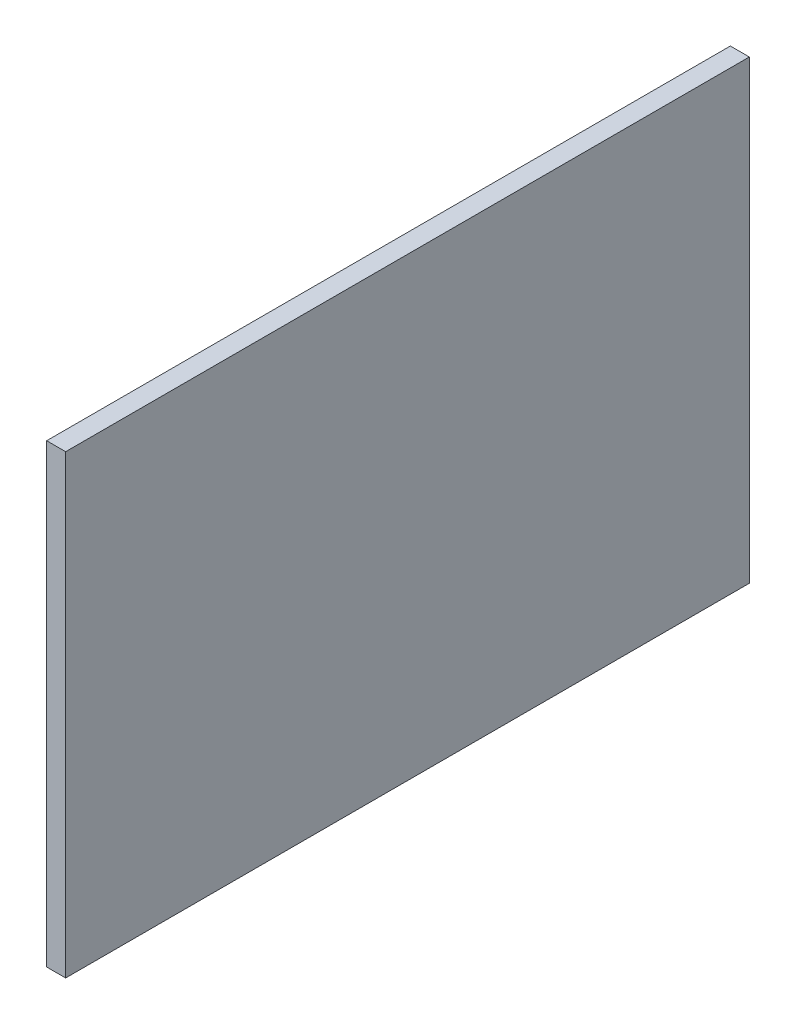
from build123d import *

# Parameters (mm, degrees)
SKETCH1_W           = 457.2
SKETCH1_H           = 304.8
BOSS_EXTRUDE1_DEPTH = 12.7


with BuildPart() as part:
    # Sketch1 → Boss-Extrude1 (new body)
    with BuildSketch(Plane(origin=(0, 0, 0), x_dir=(0, 0, -1), z_dir=(1, 0, 0))):
        with Locations((228.6, 152.4)):
            Rectangle(SKETCH1_W, SKETCH1_H)
    extrude(amount=BOSS_EXTRUDE1_DEPTH)


solid = part.part
